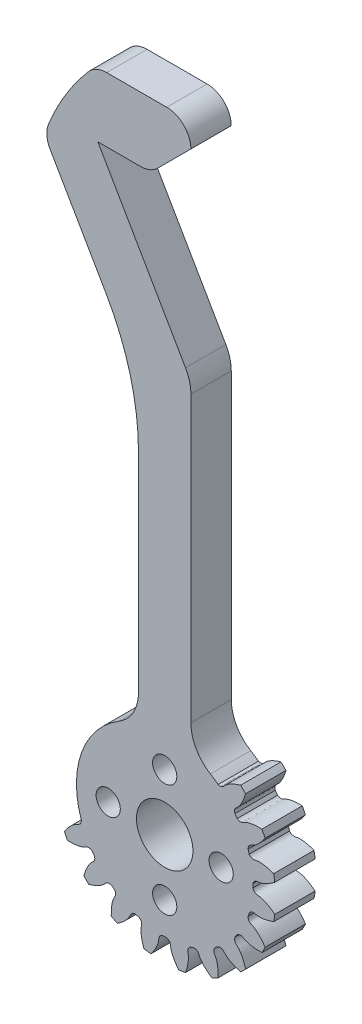
from build123d import *

# Parameters (mm, degrees)
SKETCH_1_R               = 13.75
EXTRUDE_1_DEPTH          = 5
CUT_EXTRUDE_1_DEPTH      = 21.077973005
PATTERN_CIRCULAR_1_COUNT = 20
EXTRUDE_2_DEPTH          = 5
SKETCH_4_R               = 3.5
SKETCH_4_R_2             = 1.5
CUT_EXTRUDE_2_DEPTH      = 20
CUT_EXTRUDE_START        = -10
CUT_EXTRUDE_5_DEPTH      = 10
CUT_EXTRUDE_7_DEPTH      = 10
FILLET_7_R               = 5
FILLET_8_R               = 30
FILLET_9_R               = 3
CHAMFER_1_SIZE           = 5
FILLET_10_R              = 5
FILLET_11_R              = 3


with BuildPart() as part:
    # 草图1 → 凸台-拉伸1 (new body)
    with BuildSketch(Plane.XY):
        Circle(SKETCH_1_R)
    extrude(amount=EXTRUDE_1_DEPTH)

    # 草图2 → 切除-拉伸1 (cut, through all)
    with BuildSketch(Plane.XY):
        with BuildLine():
            ThreePointArc((0.241645751, 10.934830295), (0, 10.9375), (-0.241645751, 10.934830295))
            add(Edge.make_bspline(
                [(-0.241645751, 10.934830295), (-0.763986756, 11.11684439), (-0.696355124, 11.483892124), (-0.766121321, 11.837511753), (-0.773615233, 11.871945767), (-0.782888612, 11.910793269), (-0.794115121, 11.953996045), (-0.807473925, 12.001489371), (-0.823140069, 12.053203535), (-0.841287339, 12.109063416), (-0.862087187, 12.168988684), (-0.885708875, 12.232893806), (-0.912319248, 12.300688126), (-0.942082628, 12.372275913), (-0.975160664, 12.447556439), (-1.011712206, 12.526424039), (-1.051893167, 12.608768189), (-1.095856396, 12.694473577), (-1.143751548, 12.783420187), (-1.195724957, 12.87548338), (-1.251919512, 12.970533976), (-1.312474533, 13.068438347), (-1.377525652, 13.169058507), (-1.447204695, 13.272252205), (-1.521639564, 13.377873025), (-1.600954126, 13.485770488), (-1.685268101, 13.595790151), (-1.774696952, 13.707773716), (-1.869351783, 13.821559139), (-1.969339231, 13.936980743), (-2.074761371, 14.053869328), (-2.185715611, 14.172052294), (-2.302294605, 14.291353753), (-2.424586158, 14.411594659), (-2.552673133, 14.532592924), (-2.686633373, 14.654163553), (-2.826539612, 14.776118764), (-2.972459398, 14.898268124), (-3.124455015, 15.020418683), (-3.282583418, 15.142375102), (-3.446896124, 15.2639398), (-3.676841988, 15.427049835), (-3.854915516, 15.545415751), (-3.976447477, 15.622814825)],
                knots=[0, 0, 0, 0, 0.165916003, 0.170905922, 0.176663519, 0.183188797, 0.190481754, 0.198542391, 0.207370708, 0.216966704, 0.22733038, 0.238461736, 0.250360771, 0.263027487, 0.276461881, 0.290663956, 0.30563371, 0.321371144, 0.337876258, 0.355149051, 0.373189524, 0.391997677, 0.411573509, 0.431917021, 0.453028213, 0.474907084, 0.497553636, 0.520967867, 0.545149777, 0.570099367, 0.595816637, 0.622301587, 0.649554216, 0.677574526, 0.706362514, 0.735918183, 0.766241531, 0.797332559, 0.829191267, 0.861817654, 0.895211721, 0.929373468, 1, 1, 1, 1], degree=3))
            ThreePointArc((-3.976447477, 15.622814825), (0, 16.120932901), (3.976447477, 15.622814825))
            add(Edge.make_bspline(
                [(0.241645751, 10.934830295), (0.763986756, 11.11684439), (0.696355124, 11.483892124), (0.766121321, 11.837511753), (0.773615233, 11.871945767), (0.782888612, 11.910793269), (0.794115121, 11.953996045), (0.807473925, 12.001489371), (0.823140069, 12.053203535), (0.841287339, 12.109063416), (0.862087187, 12.168988684), (0.885708875, 12.232893806), (0.912319248, 12.300688126), (0.942082628, 12.372275913), (0.975160664, 12.447556439), (1.011712206, 12.526424039), (1.051893167, 12.608768189), (1.095856396, 12.694473577), (1.143751548, 12.783420187), (1.195724957, 12.87548338), (1.251919512, 12.970533976), (1.312474533, 13.068438347), (1.377525652, 13.169058507), (1.447204695, 13.272252205), (1.521639564, 13.377873025), (1.600954126, 13.485770488), (1.685268101, 13.595790151), (1.774696952, 13.707773716), (1.869351783, 13.821559139), (1.969339231, 13.936980743), (2.074761371, 14.053869328), (2.185715611, 14.172052294), (2.302294605, 14.291353753), (2.424586158, 14.411594659), (2.552673133, 14.532592924), (2.686633373, 14.654163553), (2.826539612, 14.776118764), (2.972459398, 14.898268124), (3.124455015, 15.020418683), (3.282583418, 15.142375102), (3.446896124, 15.2639398), (3.676841988, 15.427049835), (3.854915516, 15.545415751), (3.976447477, 15.622814825)],
                knots=[0, 0, 0, 0, 0.165916003, 0.170905922, 0.176663519, 0.183188797, 0.190481754, 0.198542391, 0.207370708, 0.216966704, 0.22733038, 0.238461736, 0.250360771, 0.263027487, 0.276461881, 0.290663956, 0.30563371, 0.321371144, 0.337876258, 0.355149051, 0.373189524, 0.391997677, 0.411573509, 0.431917021, 0.453028213, 0.474907084, 0.497553636, 0.520967867, 0.545149777, 0.570099367, 0.595816637, 0.622301587, 0.649554216, 0.677574526, 0.706362514, 0.735918183, 0.766241531, 0.797332559, 0.829191267, 0.861817654, 0.895211721, 0.929373468, 1, 1, 1, 1], degree=3))
        make_face()
    cut_extrude_1 = extrude(amount=CUT_EXTRUDE_1_DEPTH, mode=Mode.SUBTRACT)

    # 阵列(圆周)1: 切除-拉伸1 ×20 about axis
    pattern_circular_1_axis = Axis((0, 0, -1.5), (0, 0, 1))
    for i in range(1, PATTERN_CIRCULAR_1_COUNT):
        add(cut_extrude_1.rotate(pattern_circular_1_axis, i * 360 / PATTERN_CIRCULAR_1_COUNT), mode=Mode.SUBTRACT)

    # 草图6 → 凸台-拉伸2 (add)
    with BuildSketch(Plane(origin=(0, 0, 0), x_dir=(-1, 0, 0), z_dir=(0, 0, -1))):
        with BuildLine():
            Line((-3.25, 0), (3.25, 0))
            Line((3.25, 0), (3.25, 10.356086019))
            Line((3.25, 10.356086019), (3.25, 13.94494264))
            Line((3.25, 13.94494264), (3.25, 33.869691994))
            Line((3.25, 33.869691994), (3.25, 36.074176466))
            Line((3.25, 36.074176466), (3.25, 40.110955299))
            ThreePointArc((3.25, 40.110955299), (0.161907275, 37.831863642), (-3.25, 36.074176466))
            Line((-3.25, 36.074176466), (-3.25, 13.94494264))
            Line((-3.25, 13.94494264), (-3.25, 10.356086019))
            Line((-3.25, 10.356086019), (-3.25, 0))
        make_face()
        with BuildLine():
            Line((3.25, 13.94494264), (3.25, 10.356086019))
            add(Edge.make_bspline(
                [(3.25, 10.356086019), (4.148237996, 10.202910202), (4.180756413, 10.652459253), (4.393103935, 11.03302397), (4.418885843, 11.076011904), (4.458931571, 11.138710403), (4.509766902, 11.213065778), (4.58267603, 11.311112911), (4.671237054, 11.420807284), (4.776478734, 11.5410308), (4.899365137, 11.670602183), (5.040791529, 11.808280759), (5.201581362, 11.952770029), (5.38248323, 12.10272148), (5.584168076, 12.256738531), (5.744241751, 12.369149234), (5.836552423, 12.430773747), (5.853360338, 12.441891848)],
                knots=[0.462155209, 0.462155209, 0.462155209, 0.462155209, 0.658484305, 0.663474224, 0.675757099, 0.683050056, 0.69993901, 0.719898682, 0.742929074, 0.769030183, 0.798202012, 0.83044456, 0.865757826, 0.904141811, 0.945596515, 0.990121938, 1, 1, 1, 1], degree=3))
            Line((5.853360338, 12.441891848), (3.25, 13.94494264))
        make_face()
        with BuildLine():
            add(Edge.make_bspline(
                [(-3.25, 10.356086019), (-4.148237996, 10.202910202), (-4.180756413, 10.652459253), (-4.393103935, 11.03302397), (-4.418885843, 11.076011904), (-4.458931571, 11.138710403), (-4.509766902, 11.213065778), (-4.58267603, 11.311112911), (-4.671237054, 11.420807284), (-4.776478734, 11.5410308), (-4.899365137, 11.670602183), (-5.040791529, 11.808280759), (-5.201581362, 11.952770029), (-5.38248323, 12.10272148), (-5.584168076, 12.256738531), (-5.744241751, 12.369149234), (-5.836552423, 12.430773747), (-5.853360338, 12.441891848)],
                knots=[-0.030413093, -0.030413093, -0.030413093, -0.030413093, 0.165916003, 0.170905922, 0.183188797, 0.190481754, 0.207370708, 0.22733038, 0.250360771, 0.276461881, 0.30563371, 0.337876258, 0.373189524, 0.411573509, 0.453028213, 0.497553636, 0.507431698, 0.507431698, 0.507431698, 0.507431698], degree=3))
            Line((-3.25, 10.356086019), (-3.25, 13.94494264))
            Line((-3.25, 13.94494264), (-5.853360338, 12.441891848))
        make_face()
        with BuildLine():
            Line((-3.25, 46.22), (-3.25, 36.074176466))
            ThreePointArc((-3.25, 36.074176466), (0.161907275, 37.831863642), (3.25, 40.110955299))
            Line((3.25, 40.110955299), (3.25, 46.22))
            Line((3.25, 46.22), (-3.25, 46.22))
        make_face()
        Polygon((-3.25, 50.24146997), (-3.25, 46.22), (3.25, 46.22), (3.25, 47.499800219), (-2.812177826, 50.999800219), align=None)
        with BuildLine():
            ThreePointArc((5.921681189, 78.19853003), (10.675535453, 72.411354991), (13.669162286, 65.54631867))
            Line((13.669162286, 65.54631867), (14.908933822, 67.693665961))
            ThreePointArc((14.908933822, 67.693665961), (12.277788076, 73.288550629), (8.520426681, 78.19853003))
            Line((8.520426681, 78.19853003), (5.921681189, 78.19853003))
        make_face()
        with BuildLine():
            Line((11.285921821, 61.418425099), (13.669162286, 65.54631867))
            ThreePointArc((13.669162286, 65.54631867), (10.675535453, 72.411354991), (5.921681189, 78.19853003))
            Line((5.921681189, 78.19853003), (0.79880964, 78.19853003))
            ThreePointArc((0.79880964, 78.19853003), (5.002402797, 74.641507127), (8.284609691, 70.22))
            ThreePointArc((8.284609691, 70.22), (10.215633383, 65.965966692), (11.285921821, 61.418425099))
        make_face()
        Polygon((-2.812177826, 50.999800219), (3.25, 47.499800219), (5.397858345, 51.22), (1.356406461, 58.22), align=None)
        Polygon((5.397858345, 51.22), (8.86195996, 57.22), (4.820508076, 64.22), (1.356406461, 58.22), align=None)
        with BuildLine():
            Line((4.820508076, 64.22), (8.86195996, 57.22))
            Line((8.86195996, 57.22), (11.285921821, 61.418425099))
            ThreePointArc((11.285921821, 61.418425099), (10.215633383, 65.965966692), (8.284609691, 70.22))
            Line((8.284609691, 70.22), (4.820508076, 64.22))
        make_face()
        with BuildLine():
            Line((1.356406461, 70.22), (8.284609691, 70.22))
            ThreePointArc((8.284609691, 70.22), (5.002402797, 74.641507127), (0.79880964, 78.19853003))
            Line((0.79880964, 78.19853003), (-0.965390309, 78.19853003))
            Line((-0.965390309, 78.19853003), (-2.107695155, 76.22))
            Line((-2.107695155, 76.22), (1.356406461, 70.22))
        make_face()
        Polygon((-3.25, 74.24146997), (-3.25, 70.22), (1.356406461, 70.22), (-2.107695155, 76.22), align=None)
        Polygon((-2.107695155, 76.22), (-0.965390309, 78.19853003), (-3.25, 78.19853003), align=None)
        Polygon((-3.25, 78.19853003), (-3.25, 74.24146997), (-2.107695155, 76.22), align=None)
    extrude(amount=-EXTRUDE_2_DEPTH)

    # 草图4 → 切除-拉伸2 (cut)
    with BuildSketch(Plane.XY.offset(5)):
        Circle(SKETCH_4_R)
        with Locations((0, 7)):
            Circle(SKETCH_4_R_2)
        with Locations((7, 0)):
            Circle(SKETCH_4_R_2)
        with Locations((0, -7)):
            Circle(SKETCH_4_R_2)
        with Locations((-7, 0)):
            Circle(SKETCH_4_R_2)
    extrude(amount=-CUT_EXTRUDE_2_DEPTH, mode=Mode.SUBTRACT)

    # 草图17 → 切除-拉伸5 (cut)
    with BuildSketch(Plane.XY.offset(5).offset(CUT_EXTRUDE_START)):
        with BuildLine():
            ThreePointArc((-10.324968963, -3.608867158), (-10.47431425, 3.149229626), (-6.622827503, 8.704427731))
            Line((-6.622827503, 8.704427731), (-10.596524004, 13.927084369))
            ThreePointArc((-10.596524004, 13.927084369), (-16.7589028, 5.038767402), (-16.519950341, -5.774187452))
            Line((-16.519950341, -5.774187452), (-10.324968963, -3.608867158))
        make_face()
    extrude(amount=CUT_EXTRUDE_5_DEPTH, mode=Mode.SUBTRACT)

    # 草图20 → 切除-拉伸7 (cut)
    with BuildSketch(Plane(origin=(0, 0, 0), x_dir=(-1, 0, 0), z_dir=(0, 0, -1))):
        with BuildLine():
            Line((-3.25, 10.443486307), (-3.25, 13.94494264))
            Line((-3.25, 13.94494264), (-5.853360338, 12.441891848))
            ThreePointArc((-5.853360338, 12.441891848), (-6.242369371, 12.251339708), (-6.625183064, 12.048628526))
            add(Edge.make_bspline(
                [(-6.231836465, 8.988499348), (-5.916238915, 9.442776183), (-6.1866993, 9.699971162), (-6.343702187, 10.03914452), (-6.36332593, 10.085270195), (-6.390511793, 10.154521122), (-6.420786297, 10.239352761), (-6.457253184, 10.355968144), (-6.493942932, 10.492092252), (-6.529346293, 10.647900169), (-6.561940927, 10.823477506), (-6.590196887, 11.018819297), (-6.61258127, 11.233829666), (-6.627563092, 11.468321604), (-6.633618126, 11.722017023), (-6.630471349, 11.9175927), (-6.626067777, 12.028495582), (-6.625183064, 12.048628526)],
                knots=[0.492568302, 0.492568302, 0.492568302, 0.492568302, 0.658484305, 0.663474224, 0.675757099, 0.683050056, 0.69993901, 0.719898682, 0.742929074, 0.769030183, 0.798202012, 0.83044456, 0.865757826, 0.904141811, 0.945596515, 0.990121938, 1, 1, 1, 1], degree=3))
            ThreePointArc((-6.231836465, 8.988499348), (-4.796410371, 9.82971789), (-3.25, 10.443486307))
        make_face()
        with BuildLine():
            Line((3.25, 13.94494264), (3.25, 10.443486307))
            ThreePointArc((3.25, 10.443486307), (4.796410371, 9.82971789), (6.231836465, 8.988499348))
            add(Edge.make_bspline(
                [(6.231836465, 8.988499348), (5.916238915, 9.442776183), (6.1866993, 9.699971162), (6.343702187, 10.03914452), (6.36332593, 10.085270195), (6.390511793, 10.154521122), (6.420786297, 10.239352761), (6.457253184, 10.355968144), (6.493942932, 10.492092252), (6.529346293, 10.647900169), (6.561940927, 10.823477506), (6.590196887, 11.018819297), (6.61258127, 11.233829666), (6.627563092, 11.468321604), (6.633618126, 11.722017023), (6.630471349, 11.9175927), (6.626067777, 12.028495582), (6.625183064, 12.048628526)],
                knots=[0, 0, 0, 0, 0.165916003, 0.170905922, 0.183188797, 0.190481754, 0.207370708, 0.22733038, 0.250360771, 0.276461881, 0.30563371, 0.337876258, 0.373189524, 0.411573509, 0.453028213, 0.497553636, 0.507431698, 0.507431698, 0.507431698, 0.507431698], degree=3))
            ThreePointArc((6.625183064, 12.048628526), (6.242369371, 12.251339708), (5.853360338, 12.441891848))
            Line((5.853360338, 12.441891848), (3.25, 13.94494264))
        make_face()
    extrude(amount=-CUT_EXTRUDE_7_DEPTH, mode=Mode.SUBTRACT)

    # 圆角7
    fillet_7_edges = [part.edges().sort_by_distance(p)[0] for p in [
        (3.25, 10.443486307, 2.5),
        (-3.25, 10.443486307, 2.5),
    ]]
    fillet(fillet_7_edges, radius=FILLET_7_R)

    # 圆角8
    fillet_8_edges = [part.edges().sort_by_distance(p)[0] for p in [
        (-3.25, 47.499800219, 2.5),
    ]]
    fillet(fillet_8_edges, radius=FILLET_8_R)

    # 圆角9
    fillet_9_edges = [part.edges().sort_by_distance(p)[0] for p in [
        (-14.908933822, 67.693665961, 2.5),
        (3.25, 78.19853003, 2.5),
        (-8.520426681, 78.19853003, 2.5),
    ]]
    fillet(fillet_9_edges, radius=FILLET_9_R)

    # 倒角1
    chamfer_1_edges = [part.edges().sort_by_distance(p)[0] for p in [
        (3.25, 70.22, 2.5),
    ]]
    chamfer(chamfer_1_edges, length=CHAMFER_1_SIZE)

    # 圆角10
    fillet_10_edges = [part.edges().sort_by_distance(p)[0] for p in [
        (3.25, 50.24146997, 2.5),
    ]]
    fillet(fillet_10_edges, radius=FILLET_10_R)

    # 圆角11
    fillet_11_edges = [part.edges().sort_by_distance(p)[0] for p in [
        (-1.75, 70.22, 2.5),
    ]]
    fillet(fillet_11_edges, radius=FILLET_11_R)


solid = part.part
